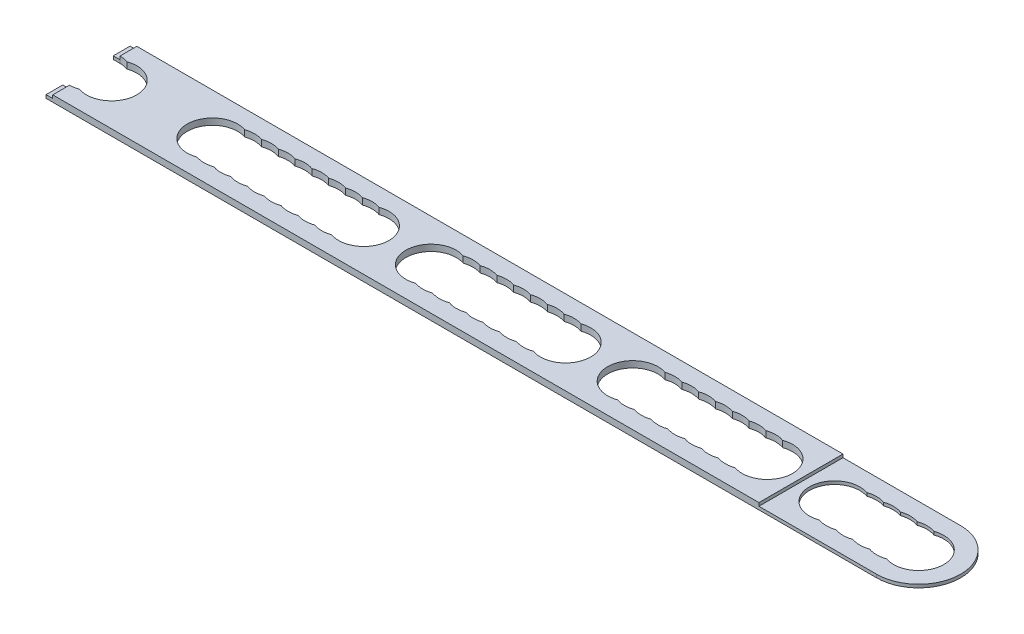
from build123d import *

# Parameters (mm, degrees)
BOSS_EXTRUDE1_DEPTH = 1.9
BOSS_EXTRUDE3_DEPTH = 0.95
SKETCH2_W           = 2
SKETCH2_H           = 5
BOSS_EXTRUDE2_DEPTH = 0.95


with BuildPart() as part:
    # Sketch1 → Boss-Extrude1 (new body)
    with BuildSketch(Plane(origin=(0, 0, 0), x_dir=(1, 0, 0), z_dir=(0, 1, 0))):
        with BuildLine():
            Line((0, -7.5), (0, -12.5))
            Line((0, -12.5), (210, -12.5))
            Line((210, -12.5), (210, 12.5))
            Line((210, 12.5), (0, 12.5))
            Line((0, 12.5), (0, 7.5))
            ThreePointArc((0, 7.5), (1.26826484, 7.391989197), (2.5, 7.071067812))
            ThreePointArc((2.5, 7.071067812), (12.5, 0), (2.5, -7.071067812))
            ThreePointArc((2.5, -7.071067812), (1.26826484, -7.391989197), (0, -7.5))
        make_face()
        with BuildLine():
            ThreePointArc((37.5, 7.071067812), (40, 7.5), (42.5, 7.071067812))
            ThreePointArc((42.5, 7.071067812), (45, 7.5), (47.5, 7.071067812))
            ThreePointArc((47.5, 7.071067812), (50, 7.5), (52.5, 7.071067812))
            ThreePointArc((52.5, 7.071067812), (55, 7.5), (57.5, 7.071067812))
            ThreePointArc((57.5, 7.071067812), (60, 7.5), (62.5, 7.071067812))
            ThreePointArc((62.5, 7.071067812), (65, 7.5), (67.5, 7.071067812))
            ThreePointArc((67.5, 7.071067812), (70, 7.5), (72.5, 7.071067812))
            ThreePointArc((72.5, 7.071067812), (75, 7.5), (77.5, 7.071067812))
            ThreePointArc((77.5, 7.071067812), (87.5, 0), (77.5, -7.071067812))
            ThreePointArc((77.5, -7.071067812), (75, -7.5), (72.5, -7.071067812))
            ThreePointArc((72.5, -7.071067812), (70, -7.5), (67.5, -7.071067812))
            ThreePointArc((67.5, -7.071067812), (65, -7.5), (62.5, -7.071067812))
            ThreePointArc((62.5, -7.071067812), (60, -7.5), (57.5, -7.071067812))
            ThreePointArc((57.5, -7.071067812), (55, -7.5), (52.5, -7.071067812))
            ThreePointArc((52.5, -7.071067812), (50, -7.5), (47.5, -7.071067812))
            ThreePointArc((47.5, -7.071067812), (45, -7.5), (42.5, -7.071067812))
            ThreePointArc((42.5, -7.071067812), (40, -7.5), (37.5, -7.071067812))
            ThreePointArc((37.5, -7.071067812), (27.5, 0), (37.5, 7.071067812))
        make_face(mode=Mode.SUBTRACT)
        with BuildLine():
            ThreePointArc((102.5, 7.071067812), (105, 7.5), (107.5, 7.071067812))
            ThreePointArc((107.5, 7.071067812), (110, 7.5), (112.5, 7.071067812))
            ThreePointArc((112.5, 7.071067812), (115, 7.5), (117.5, 7.071067812))
            ThreePointArc((117.5, 7.071067812), (120, 7.5), (122.5, 7.071067812))
            ThreePointArc((122.5, 7.071067812), (125, 7.5), (127.5, 7.071067812))
            ThreePointArc((127.5, 7.071067812), (130, 7.5), (132.5, 7.071067812))
            ThreePointArc((132.5, 7.071067812), (135, 7.5), (137.5, 7.071067812))
            ThreePointArc((137.5, 7.071067812), (147.5, 0), (137.5, -7.071067812))
            ThreePointArc((137.5, -7.071067812), (135, -7.5), (132.5, -7.071067812))
            ThreePointArc((132.5, -7.071067812), (130, -7.5), (127.5, -7.071067812))
            ThreePointArc((127.5, -7.071067812), (125, -7.5), (122.5, -7.071067812))
            ThreePointArc((122.5, -7.071067812), (120, -7.5), (117.5, -7.071067812))
            ThreePointArc((117.5, -7.071067812), (115, -7.5), (112.5, -7.071067812))
            ThreePointArc((112.5, -7.071067812), (110, -7.5), (107.5, -7.071067812))
            ThreePointArc((107.5, -7.071067812), (105, -7.5), (102.5, -7.071067812))
            ThreePointArc((102.5, -7.071067812), (92.5, 0), (102.5, 7.071067812))
        make_face(mode=Mode.SUBTRACT)
        with BuildLine():
            ThreePointArc((162.5, 7.071067812), (165, 7.5), (167.5, 7.071067812))
            ThreePointArc((167.5, 7.071067812), (170, 7.5), (172.5, 7.071067812))
            ThreePointArc((172.5, 7.071067812), (175, 7.5), (177.5, 7.071067812))
            ThreePointArc((177.5, 7.071067812), (180, 7.5), (182.5, 7.071067812))
            ThreePointArc((182.5, 7.071067812), (185, 7.5), (187.5, 7.071067812))
            ThreePointArc((187.5, 7.071067812), (190, 7.5), (192.5, 7.071067812))
            ThreePointArc((192.5, 7.071067812), (195, 7.5), (197.5, 7.071067812))
            ThreePointArc((197.5, 7.071067812), (207.5, 0), (197.5, -7.071067812))
            ThreePointArc((197.5, -7.071067812), (195, -7.5), (192.5, -7.071067812))
            ThreePointArc((192.5, -7.071067812), (190, -7.5), (187.5, -7.071067812))
            ThreePointArc((187.5, -7.071067812), (185, -7.5), (182.5, -7.071067812))
            ThreePointArc((182.5, -7.071067812), (180, -7.5), (177.5, -7.071067812))
            ThreePointArc((177.5, -7.071067812), (175, -7.5), (172.5, -7.071067812))
            ThreePointArc((172.5, -7.071067812), (170, -7.5), (167.5, -7.071067812))
            ThreePointArc((167.5, -7.071067812), (165, -7.5), (162.5, -7.071067812))
            ThreePointArc((162.5, -7.071067812), (152.5, 0), (162.5, 7.071067812))
        make_face(mode=Mode.SUBTRACT)
    extrude(amount=BOSS_EXTRUDE1_DEPTH)

    # Sketch1<3> → Boss-Extrude3 (add)
    with BuildSketch(Plane(origin=(0, 0, 0), x_dir=(1, 0, 0), z_dir=(0, 1, 0))):
        with BuildLine():
            Line((210, -12.5), (245, -12.5))
            ThreePointArc((245, -12.5), (257.5, 0), (245, 12.5))
            Line((245, 12.5), (210, 12.5))
            Line((210, 12.5), (210, -12.5))
        make_face()
        with BuildLine():
            ThreePointArc((222.5, -7.071067812), (212.5, 0), (222.5, 7.071067812))
            ThreePointArc((222.5, 7.071067812), (225, 7.5), (227.5, 7.071067812))
            ThreePointArc((227.5, 7.071067812), (230, 7.5), (232.5, 7.071067812))
            ThreePointArc((232.5, 7.071067812), (235, 7.5), (237.5, 7.071067812))
            ThreePointArc((237.5, 7.071067812), (240, 7.5), (242.5, 7.071067812))
            ThreePointArc((242.5, 7.071067812), (252.5, 0), (242.5, -7.071067812))
            ThreePointArc((242.5, -7.071067812), (240, -7.5), (237.5, -7.071067812))
            ThreePointArc((237.5, -7.071067812), (235, -7.5), (232.5, -7.071067812))
            ThreePointArc((232.5, -7.071067812), (230, -7.5), (227.5, -7.071067812))
            ThreePointArc((227.5, -7.071067812), (225, -7.5), (222.5, -7.071067812))
        make_face(mode=Mode.SUBTRACT)
    extrude(amount=BOSS_EXTRUDE3_DEPTH)

    # Sketch2 → Boss-Extrude2 (add)
    with BuildSketch(Plane(origin=(0, 0, 0), x_dir=(1, 0, 0), z_dir=(0, 1, 0))):
        with Locations((-1, 10)):
            Rectangle(SKETCH2_W, SKETCH2_H)
        with Locations((-1, -10)):
            Rectangle(SKETCH2_W, SKETCH2_H)
    extrude(amount=BOSS_EXTRUDE2_DEPTH)


solid = part.part
